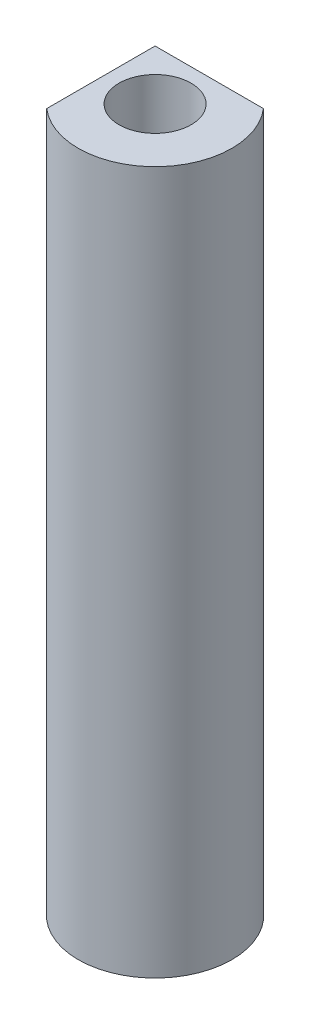
from build123d import *

# Parameters (mm, degrees)
SKETCH1_R           = 4.9
SKETCH1_R_2         = 2.3
BOSS_EXTRUDE1_DEPTH = 44.8
SKETCH2_W           = 12.911728521
SKETCH2_H           = 2.871421643
CUT_EXTRUDE1_DEPTH  = 45
SKETCH3_W           = 17.671201811
SKETCH3_H           = 20
CUT_EXTRUDE2_DEPTH  = 40


with BuildPart() as part:
    # Sketch1 → Boss-Extrude1 (new body)
    with BuildSketch(Plane(origin=(0, 0, 0), x_dir=(1, 0, 0), z_dir=(0, 1, 0))):
        with Locations(Location((0, 0, 0), (0, 0, 270))):
            Circle(SKETCH1_R)
        with Locations(Location((0, 0, 0), (0, 0, 270))):
            Circle(SKETCH1_R_2, mode=Mode.SUBTRACT)
    extrude(amount=BOSS_EXTRUDE1_DEPTH)

    # Sketch2 → Cut-Extrude1 (cut)
    with BuildSketch(Plane(origin=(0, 44.8, 0), x_dir=(1, 0, 0), z_dir=(0, 1, 0))):
        with Locations((0.901888867, 4.635710822)):
            Rectangle(SKETCH2_W, SKETCH2_H)
    extrude(amount=-CUT_EXTRUDE1_DEPTH, mode=Mode.SUBTRACT)

    # Sketch3 → Cut-Extrude2 (cut)
    with BuildSketch(Plane(origin=(0, 44.8, 0), x_dir=(1, 0, 0), z_dir=(0, 1, 0))):
        with Locations((-12.035600906, 4.200665125)):
            Rectangle(SKETCH3_W, SKETCH3_H)
    extrude(amount=-CUT_EXTRUDE2_DEPTH, mode=Mode.SUBTRACT)


solid = part.part
